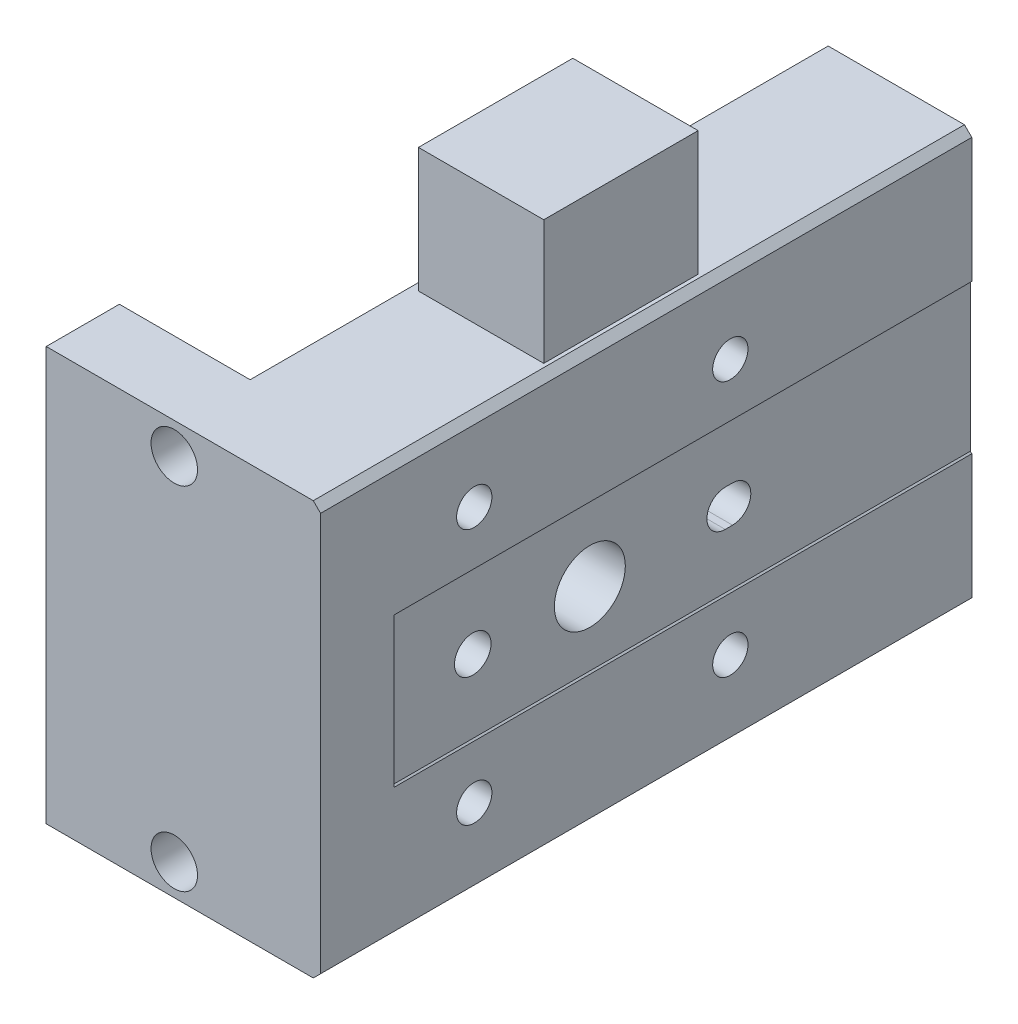
from build123d import *

# Parameters (mm, degrees)
BASE_EXTRUDE_DEPTH               = 10
BOSS_EXTRUDE1_DEPTH              = 79
BOSS_EXTRUDE3_DEPTH              = 10
F_9_7_DIAMETER_HOLE1_D           = 9.7
F_10_32_TAPPED_HOLE1_D           = 4.0386
F_10_32_TAPPED_HOLE1_DEPTH       = 12.8624
F_10_32_TAPPED_HOLE1_CBORE_D     = 4.826
F_10_32_TAPPED_HOLE1_CBORE_DEPTH = 8.9
F_10_32_TAPPED_HOLE1_TIP         = 1.213317848
F_1_4_20_TAPPED_HOLE1_D          = 6.35
F_1_4_20_TAPPED_HOLE1_DEPTH      = 10
CUT_EXTRUDE1_DEPTH               = 4
HOLE1_D                          = 5
HOLE1_DEPTH                      = 4
SKETCH14_W                       = 17.1292
SKETCH14_H                       = 21.1
BOSS_EXTRUDE2_DEPTH              = 17
CHAMFER1_SIZE                    = 1


with BuildPart() as part:
    # Sketch1 → Base-Extrude (new body)
    with BuildSketch(Plane.XY.offset(-1145.012692433)):
        Polygon((-7.6854, 28.25), (29.8146, 28.25), (29.8146, 10.2), (29.6146, 10), (29.6146, -10), (29.8146, -10.2), (29.8146, -28.25), (-7.6854, -28.25), align=None)
    extrude(amount=BASE_EXTRUDE_DEPTH)

    # Sketch3 → Boss-Extrude1 (add)
    with BuildSketch(Plane(origin=(0, 0, -1145.012692433), x_dir=(-1, 0, 0), z_dir=(0, 0, -1))):
        Polygon((-29.8146, 10.2), (-29.8146, 28.25), (-10.1854, 28.25), (-10.1854, -28.25), (-29.8146, -28.25), (-29.8146, -10.2), (-29.6146, -10), (-29.6146, 10), align=None)
    extrude(amount=BOSS_EXTRUDE1_DEPTH)

    # Sketch15 → Boss-Extrude3 (add)
    with BuildSketch(Plane.XY.offset(-1135.012692433)):
        Polygon((29.8146, -10.2), (29.6146, -10), (29.6146, 10), (29.8146, 10.2), align=None)
    extrude(amount=-BOSS_EXTRUDE3_DEPTH)

    # 9.7 Diameter Hole1 (through all)
    with Locations(Plane(origin=(29.6146, 0, 0), x_dir=(0, 0, -1), z_dir=(1, 0, 0))):
        with Locations((1172.012692433, 0)):
            Hole(F_9_7_DIAMETER_HOLE1_D / 2)

    # #10-32 Tapped Hole1
    with Locations(Plane(origin=(29.8146, 0, 0), x_dir=(0, 0, -1), z_dir=(1, 0, 0))):
        with Locations((1156.012692433, 17.5), (1191.012692433, 17.5), (1156.012692433, -17.5), (1191.012692433, -17.5)):
            CounterBoreHole(F_10_32_TAPPED_HOLE1_D / 2, F_10_32_TAPPED_HOLE1_CBORE_D / 2, F_10_32_TAPPED_HOLE1_CBORE_DEPTH, depth=F_10_32_TAPPED_HOLE1_DEPTH)
            with Locations((0, 0, -(F_10_32_TAPPED_HOLE1_DEPTH + F_10_32_TAPPED_HOLE1_TIP / 2))):  # 118° drill point
                Cone(0, F_10_32_TAPPED_HOLE1_D / 2, F_10_32_TAPPED_HOLE1_TIP, mode=Mode.SUBTRACT)

    # 1/4-20 Tapped Hole1
    with Locations(Plane.XY.offset(-1135.012692433)):
        with Locations((9.8146, 24), (9.8146, -24)):
            Hole(F_1_4_20_TAPPED_HOLE1_D / 2, depth=F_1_4_20_TAPPED_HOLE1_DEPTH)

    # Sketch11 → Cut-Extrude1 (cut)
    with BuildSketch(Plane(origin=(29.6146, 0, 0), x_dir=(0, 0, -1), z_dir=(1, 0, 0))):
        with BuildLine():
            Line((1190.512692433, 2.5), (1191.512692433, 2.5))
            ThreePointArc((1191.512692433, 2.5), (1194.012692433, 0), (1191.512692433, -2.5))
            Line((1191.512692433, -2.5), (1190.512692433, -2.5))
            ThreePointArc((1190.512692433, -2.5), (1188.012692433, 0), (1190.512692433, 2.5))
        make_face()
    extrude(amount=-CUT_EXTRUDE1_DEPTH, mode=Mode.SUBTRACT)

    # Hole1
    with Locations(Plane(origin=(29.6146, 0, 0), x_dir=(0, 0, -1), z_dir=(1, 0, 0))):
        with Locations((1156.012692433, 0)):
            Hole(HOLE1_D / 2, depth=HOLE1_DEPTH)

    # Sketch14 → Boss-Extrude2 (add)
    with BuildSketch(Plane(origin=(0, 28.25, 0), x_dir=(-1, 0, 0), z_dir=(0, 1, 0))):
        with Locations((-19.75, -1177.562692433)):
            Rectangle(SKETCH14_W, SKETCH14_H)
    extrude(amount=BOSS_EXTRUDE2_DEPTH)

    # Chamfer1
    chamfer1_edges = [part.edges().sort_by_distance(p)[0] for p in [
        (29.8146, -28.25, -1179.512692433),
        (29.8146, 28.25, -1179.512692433),
    ]]
    chamfer(chamfer1_edges, length=CHAMFER1_SIZE)


solid = part.part
